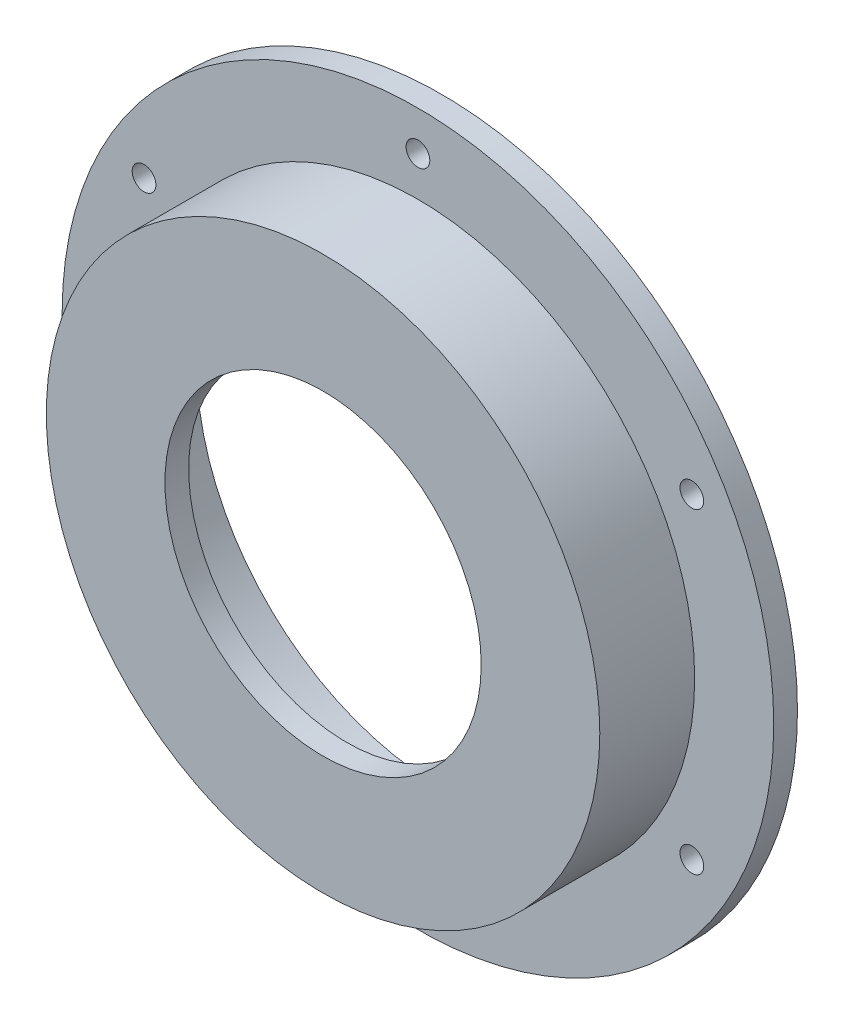
from build123d import *

# Parameters (mm, degrees)
SKETCH1_R               = 45
BOSS_EXTRUDE3_DEPTH     = 3
SKETCH2_R               = 35
BOSS_EXTRUDE4_DEPTH     = 12
SKETCH3_R               = 31
CUT_EXTRUDE2_DEPTH      = 66.383484153
BOSS_EXTRUDE5_START     = -3
SKETCH4_R               = 35
SKETCH4_R_2             = 20
BOSS_EXTRUDE5_DEPTH     = 3
CUT_EXTRUDE3_DEPTH      = 65.761099435
CUT_EXTRUDE3_DEPTH_BACK = 65.761099435
SKETCH5_R               = 1.5


with BuildPart() as part:
    # Sketch1 → Boss-Extrude3 (new body)
    with BuildSketch(Plane.XY):
        Circle(SKETCH1_R)
    extrude(amount=BOSS_EXTRUDE3_DEPTH)

    # Sketch2 → Boss-Extrude4 (add)
    with BuildSketch(Plane.XY.offset(3)):
        Circle(SKETCH2_R)
    extrude(amount=BOSS_EXTRUDE4_DEPTH)

    # Sketch3 → Cut-Extrude2 (cut, through all)
    with BuildSketch(Plane.XY.offset(15)):
        Circle(SKETCH3_R)
    extrude(amount=-CUT_EXTRUDE2_DEPTH, mode=Mode.SUBTRACT)

    # Sketch4 → Boss-Extrude5 (add)
    with BuildSketch(Plane.XY.offset(15).offset(BOSS_EXTRUDE5_START)):
        Circle(SKETCH4_R)
        Circle(SKETCH4_R_2, mode=Mode.SUBTRACT)
    extrude(amount=BOSS_EXTRUDE5_DEPTH)

    # Sketch5 → Cut-Extrude3 (cut, two sides: drawn at the far end of the back side and taken through both)
    with BuildSketch(Plane.XY.offset(3).offset(-CUT_EXTRUDE3_DEPTH_BACK)):
        with Locations((0, 40)):
            Circle(SKETCH5_R)
        with Locations((34.641016151, 20)):
            Circle(SKETCH5_R)
        with Locations((34.641016151, -20)):
            Circle(SKETCH5_R)
        with Locations((0, -40)):
            Circle(SKETCH5_R)
        with Locations((-34.641016151, -20)):
            Circle(SKETCH5_R)
        with Locations((-34.641016151, 20)):
            Circle(SKETCH5_R)
    extrude(amount=CUT_EXTRUDE3_DEPTH + CUT_EXTRUDE3_DEPTH_BACK, mode=Mode.SUBTRACT)


solid = part.part
